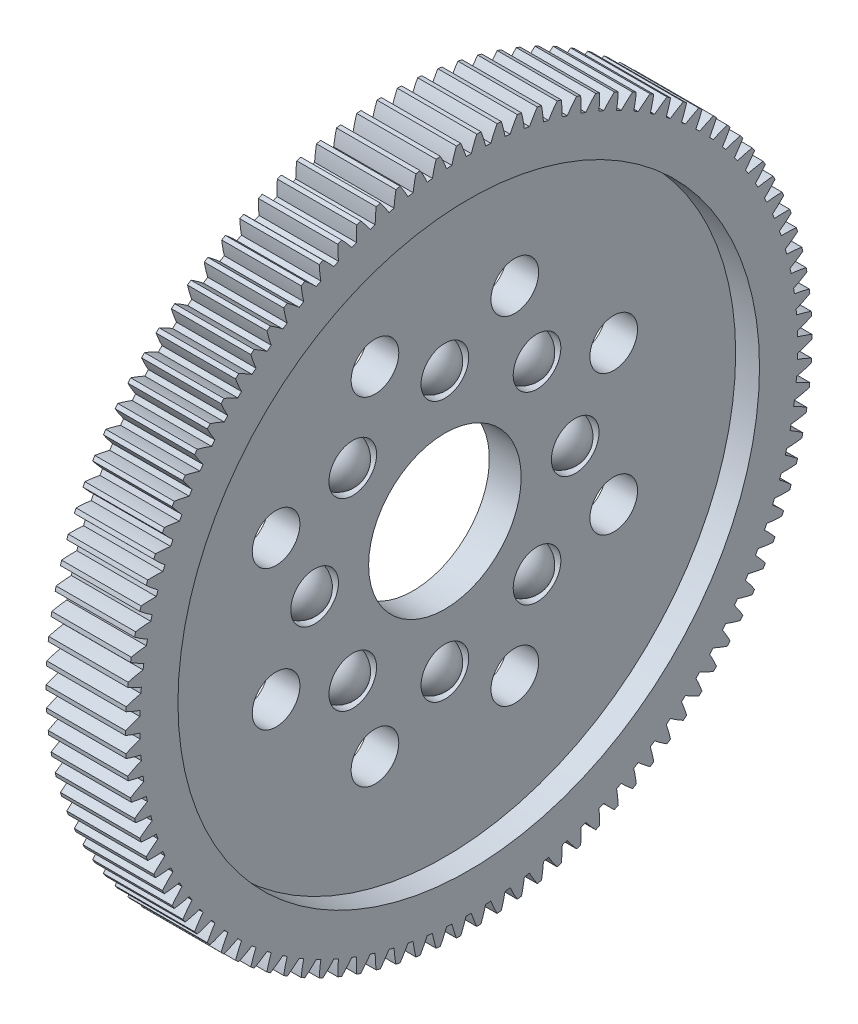
from build123d import *

# Parameters (mm, degrees)
BASPROSKE_W                    = 5
BASPROSKE_H                    = 21.6
TOOTHCUT_DEPTH                 = 31.953513532
TEETHCUTS_COUNT                = 106
BORSKE_R                       = 4.8
BORE_DEPTH                     = 50.0000508
SKETCH2_R                      = 18.3
CUT_EXTRUDE1_DEPTH             = 1.5
CUT_EXTRUDE2_REACH             = 32.645
SKETCH3_R                      = 1.5
CUT_EXTRUDE2_DIRECTION_2_REACH = 32.645
CIRPATTERN3_COUNT              = 8


with BuildPart() as part:
    # BasProSke → Base-Revolve (revolve)
    with BuildSketch(Plane(origin=(0, 0, 0), x_dir=(1, 0, 0), z_dir=(0, 1, 0))):
        with Locations((2.5, 10.8)):
            Rectangle(BASPROSKE_W, BASPROSKE_H)
    revolve(axis=Axis((-10, 0, 0), (1, 0, 0)))

    # TooCutSke → ToothCut (cut, through all)
    with BuildSketch(Plane(origin=(0, 0, 0), x_dir=(0, 0, -1), z_dir=(1, 0, 0))):
        with BuildLine():
            ThreePointArc((0.164803514, 20.698343914), (0, 20.699), (-0.164803514, 20.698343914))
            ThreePointArc((-0.164803514, 20.698343914), (-0.327553518, 21.163904781), (-0.517093365, 21.619216906))
            ThreePointArc((-0.517093365, 21.619216906), (0, 21.6254), (0.517093365, 21.619216906))
            ThreePointArc((0.517093365, 21.619216906), (0.327553518, 21.163904781), (0.164803514, 20.698343914))
        make_face()
    toothcut = extrude(amount=TOOTHCUT_DEPTH, mode=Mode.SUBTRACT)

    # TeethCuts: ToothCut ×106 about axis
    teethcuts_axis = Axis((-10, 0, 0), (1, 0, 0))
    for i in range(1, TEETHCUTS_COUNT):
        add(toothcut.rotate(teethcuts_axis, i * 360 / TEETHCUTS_COUNT), mode=Mode.SUBTRACT)

    # BorSke → Bore (cut, symmetric)
    with BuildSketch(Plane(origin=(0, 0, 0), x_dir=(0, 0, -1), z_dir=(1, 0, 0))):
        with Locations(Location((0, 0, 0), (0, 0, 180))):
            Circle(BORSKE_R)
    extrude(amount=BORE_DEPTH, both=True, mode=Mode.SUBTRACT)

    # Sketch2 → Cut-Extrude1 (cut)
    with BuildSketch(Plane(origin=(5, 0, 0), x_dir=(0, 0, -1), z_dir=(1, 0, 0))):
        Circle(SKETCH2_R)
    cut_extrude1 = extrude(amount=-CUT_EXTRUDE1_DEPTH, mode=Mode.SUBTRACT)

    # Mirror1: Cut-Extrude1 across plane
    add(cut_extrude1.mirror(Plane(origin=(2.5, 0, 0), x_dir=(0, 0, 1), z_dir=(1, 0, 0))), mode=Mode.SUBTRACT)

    # Sketch3 → Cut-Extrude2 (cut, up to next)
    with BuildSketch(Plane(origin=(2.5, 0, 0), x_dir=(0, 0, -1), z_dir=(1, 0, 0)), mode=Mode.PRIVATE) as cut_extrude2_sk1:
        with Locations(Location((0, 8.2, 0), (0, 0, 180))):
            Circle(SKETCH3_R)
    cut_extrude2_tool1 = extrude(cut_extrude2_sk1.sketch, amount=-CUT_EXTRUDE2_REACH, mode=Mode.PRIVATE) & part.part
    # Sketch3 → Cut-Extrude2 (cut, up to next)
    with BuildSketch(Plane(origin=(2.5, 0, 0), x_dir=(0, 0, -1), z_dir=(1, 0, 0)), mode=Mode.PRIVATE) as cut_extrude2_sk2:
        with Locations(Location((5.798275606, 5.798275606, 0), (0, 0, 180))):
            Circle(SKETCH3_R)
    cut_extrude2_tool2 = extrude(cut_extrude2_sk2.sketch, amount=-CUT_EXTRUDE2_REACH, mode=Mode.PRIVATE) & part.part
    # Sketch3 → Cut-Extrude2 (cut, up to next)
    with BuildSketch(Plane(origin=(2.5, 0, 0), x_dir=(0, 0, -1), z_dir=(1, 0, 0)), mode=Mode.PRIVATE) as cut_extrude2_sk3:
        with Locations(Location((8.2, 0, 0), (0, 0, 180))):
            Circle(SKETCH3_R)
    cut_extrude2_tool3 = extrude(cut_extrude2_sk3.sketch, amount=-CUT_EXTRUDE2_REACH, mode=Mode.PRIVATE) & part.part
    # Sketch3 → Cut-Extrude2 (cut, up to next)
    with BuildSketch(Plane(origin=(2.5, 0, 0), x_dir=(0, 0, -1), z_dir=(1, 0, 0)), mode=Mode.PRIVATE) as cut_extrude2_sk4:
        with Locations(Location((5.798275606, -5.798275606, 0), (0, 0, 180))):
            Circle(SKETCH3_R)
    cut_extrude2_tool4 = extrude(cut_extrude2_sk4.sketch, amount=-CUT_EXTRUDE2_REACH, mode=Mode.PRIVATE) & part.part
    # Sketch3 → Cut-Extrude2 (cut, up to next)
    with BuildSketch(Plane(origin=(2.5, 0, 0), x_dir=(0, 0, -1), z_dir=(1, 0, 0)), mode=Mode.PRIVATE) as cut_extrude2_sk5:
        with Locations(Location((0, -8.2, 0), (0, 0, 180))):
            Circle(SKETCH3_R)
    cut_extrude2_tool5 = extrude(cut_extrude2_sk5.sketch, amount=-CUT_EXTRUDE2_REACH, mode=Mode.PRIVATE) & part.part
    # Sketch3 → Cut-Extrude2 (cut, up to next)
    with BuildSketch(Plane(origin=(2.5, 0, 0), x_dir=(0, 0, -1), z_dir=(1, 0, 0)), mode=Mode.PRIVATE) as cut_extrude2_sk6:
        with Locations(Location((-5.798275606, -5.798275606, 0), (0, 0, 180))):
            Circle(SKETCH3_R)
    cut_extrude2_tool6 = extrude(cut_extrude2_sk6.sketch, amount=-CUT_EXTRUDE2_REACH, mode=Mode.PRIVATE) & part.part
    # Sketch3 → Cut-Extrude2 (cut, up to next)
    with BuildSketch(Plane(origin=(2.5, 0, 0), x_dir=(0, 0, -1), z_dir=(1, 0, 0)), mode=Mode.PRIVATE) as cut_extrude2_sk7:
        with Locations(Location((-8.2, 0, 0), (0, 0, 180))):
            Circle(SKETCH3_R)
    cut_extrude2_tool7 = extrude(cut_extrude2_sk7.sketch, amount=-CUT_EXTRUDE2_REACH, mode=Mode.PRIVATE) & part.part
    # Sketch3 → Cut-Extrude2 (cut, up to next)
    with BuildSketch(Plane(origin=(2.5, 0, 0), x_dir=(0, 0, -1), z_dir=(1, 0, 0)), mode=Mode.PRIVATE) as cut_extrude2_sk8:
        with Locations(Location((-5.798275606, 5.798275606, 0), (0, 0, 180))):
            Circle(SKETCH3_R)
    cut_extrude2_tool8 = extrude(cut_extrude2_sk8.sketch, amount=-CUT_EXTRUDE2_REACH, mode=Mode.PRIVATE) & part.part
    # Sketch3 → Cut-Extrude2 (cut, up to next)
    with BuildSketch(Plane(origin=(2.5, 0, 0), x_dir=(0, 0, -1), z_dir=(1, 0, 0)), mode=Mode.PRIVATE) as cut_extrude2_sk9:
        with Locations(Location((-4.400859472, 10.624614624, 0), (0, 0, 180))):
            Circle(SKETCH3_R)
    cut_extrude2_tool9 = extrude(cut_extrude2_sk9.sketch, amount=-CUT_EXTRUDE2_REACH, mode=Mode.PRIVATE) & part.part
    # Sketch3 → Cut-Extrude2 (cut, up to next)
    with BuildSketch(Plane(origin=(2.5, 0, 0), x_dir=(0, 0, -1), z_dir=(1, 0, 0)), mode=Mode.PRIVATE) as cut_extrude2_sk10:
        with Locations(Location((4.400859472, 10.624614624, 0), (0, 0, 180))):
            Circle(SKETCH3_R)
    cut_extrude2_tool10 = extrude(cut_extrude2_sk10.sketch, amount=-CUT_EXTRUDE2_REACH, mode=Mode.PRIVATE) & part.part
    # Sketch3 → Cut-Extrude2 (cut, up to next)
    with BuildSketch(Plane(origin=(2.5, 0, 0), x_dir=(0, 0, -1), z_dir=(1, 0, 0)), mode=Mode.PRIVATE) as cut_extrude2_sk11:
        with Locations(Location((10.624614624, 4.400859472, 0), (0, 0, 180))):
            Circle(SKETCH3_R)
    cut_extrude2_tool11 = extrude(cut_extrude2_sk11.sketch, amount=-CUT_EXTRUDE2_REACH, mode=Mode.PRIVATE) & part.part
    # Sketch3 → Cut-Extrude2 (cut, up to next)
    with BuildSketch(Plane(origin=(2.5, 0, 0), x_dir=(0, 0, -1), z_dir=(1, 0, 0)), mode=Mode.PRIVATE) as cut_extrude2_sk12:
        with Locations(Location((10.624614624, -4.400859472, 0), (0, 0, 180))):
            Circle(SKETCH3_R)
    cut_extrude2_tool12 = extrude(cut_extrude2_sk12.sketch, amount=-CUT_EXTRUDE2_REACH, mode=Mode.PRIVATE) & part.part
    # Sketch3 → Cut-Extrude2 (cut, up to next)
    with BuildSketch(Plane(origin=(2.5, 0, 0), x_dir=(0, 0, -1), z_dir=(1, 0, 0)), mode=Mode.PRIVATE) as cut_extrude2_sk13:
        with Locations(Location((4.400859472, -10.624614624, 0), (0, 0, 180))):
            Circle(SKETCH3_R)
    cut_extrude2_tool13 = extrude(cut_extrude2_sk13.sketch, amount=-CUT_EXTRUDE2_REACH, mode=Mode.PRIVATE) & part.part
    # Sketch3 → Cut-Extrude2 (cut, up to next)
    with BuildSketch(Plane(origin=(2.5, 0, 0), x_dir=(0, 0, -1), z_dir=(1, 0, 0)), mode=Mode.PRIVATE) as cut_extrude2_sk14:
        with Locations(Location((-4.400859472, -10.624614624, 0), (0, 0, 180))):
            Circle(SKETCH3_R)
    cut_extrude2_tool14 = extrude(cut_extrude2_sk14.sketch, amount=-CUT_EXTRUDE2_REACH, mode=Mode.PRIVATE) & part.part
    # Sketch3 → Cut-Extrude2 (cut, up to next)
    with BuildSketch(Plane(origin=(2.5, 0, 0), x_dir=(0, 0, -1), z_dir=(1, 0, 0)), mode=Mode.PRIVATE) as cut_extrude2_sk15:
        with Locations(Location((-10.624614624, -4.400859472, 0), (0, 0, 180))):
            Circle(SKETCH3_R)
    cut_extrude2_tool15 = extrude(cut_extrude2_sk15.sketch, amount=-CUT_EXTRUDE2_REACH, mode=Mode.PRIVATE) & part.part
    # Sketch3 → Cut-Extrude2 (cut, up to next)
    with BuildSketch(Plane(origin=(2.5, 0, 0), x_dir=(0, 0, -1), z_dir=(1, 0, 0)), mode=Mode.PRIVATE) as cut_extrude2_sk16:
        with Locations(Location((-10.624614624, 4.400859472, 0), (0, 0, 180))):
            Circle(SKETCH3_R)
    cut_extrude2_tool16 = extrude(cut_extrude2_sk16.sketch, amount=-CUT_EXTRUDE2_REACH, mode=Mode.PRIVATE) & part.part
    add(cut_extrude2_tool1.solids().sort_by_distance((2.5, 8.2, 0))[0], mode=Mode.SUBTRACT)
    add(cut_extrude2_tool2.solids().sort_by_distance((2.5, 5.798276, -5.798276))[0], mode=Mode.SUBTRACT)
    add(cut_extrude2_tool3.solids().sort_by_distance((2.5, 0, -8.2))[0], mode=Mode.SUBTRACT)
    add(cut_extrude2_tool4.solids().sort_by_distance((2.5, -5.798276, -5.798276))[0], mode=Mode.SUBTRACT)
    add(cut_extrude2_tool5.solids().sort_by_distance((2.5, -8.2, 0))[0], mode=Mode.SUBTRACT)
    add(cut_extrude2_tool6.solids().sort_by_distance((2.5, -5.798276, 5.798276))[0], mode=Mode.SUBTRACT)
    add(cut_extrude2_tool7.solids().sort_by_distance((2.5, 0, 8.2))[0], mode=Mode.SUBTRACT)
    add(cut_extrude2_tool8.solids().sort_by_distance((2.5, 5.798276, 5.798276))[0], mode=Mode.SUBTRACT)
    add(cut_extrude2_tool9.solids().sort_by_distance((2.5, 10.624615, 4.400859))[0], mode=Mode.SUBTRACT)
    add(cut_extrude2_tool10.solids().sort_by_distance((2.5, 10.624615, -4.400859))[0], mode=Mode.SUBTRACT)
    add(cut_extrude2_tool11.solids().sort_by_distance((2.5, 4.400859, -10.624615))[0], mode=Mode.SUBTRACT)
    add(cut_extrude2_tool12.solids().sort_by_distance((2.5, -4.400859, -10.624615))[0], mode=Mode.SUBTRACT)
    add(cut_extrude2_tool13.solids().sort_by_distance((2.5, -10.624615, -4.400859))[0], mode=Mode.SUBTRACT)
    add(cut_extrude2_tool14.solids().sort_by_distance((2.5, -10.624615, 4.400859))[0], mode=Mode.SUBTRACT)
    add(cut_extrude2_tool15.solids().sort_by_distance((2.5, -4.400859, 10.624615))[0], mode=Mode.SUBTRACT)
    add(cut_extrude2_tool16.solids().sort_by_distance((2.5, 4.400859, 10.624615))[0], mode=Mode.SUBTRACT)

    # Sketch3 → Cut-Extrude2 direction 2 (cut, up to next)
    with BuildSketch(Plane(origin=(2.5, 0, 0), x_dir=(0, 0, -1), z_dir=(1, 0, 0)), mode=Mode.PRIVATE) as cut_extrude2_direction_2_sk1:
        with Locations(Location((0, 8.2, 0), (0, 0, 180))):
            Circle(SKETCH3_R)
    cut_extrude2_direction_2_tool1 = extrude(cut_extrude2_direction_2_sk1.sketch, amount=CUT_EXTRUDE2_DIRECTION_2_REACH, mode=Mode.PRIVATE) & part.part
    # Sketch3 → Cut-Extrude2 direction 2 (cut, up to next)
    with BuildSketch(Plane(origin=(2.5, 0, 0), x_dir=(0, 0, -1), z_dir=(1, 0, 0)), mode=Mode.PRIVATE) as cut_extrude2_direction_2_sk2:
        with Locations(Location((5.798275606, 5.798275606, 0), (0, 0, 180))):
            Circle(SKETCH3_R)
    cut_extrude2_direction_2_tool2 = extrude(cut_extrude2_direction_2_sk2.sketch, amount=CUT_EXTRUDE2_DIRECTION_2_REACH, mode=Mode.PRIVATE) & part.part
    # Sketch3 → Cut-Extrude2 direction 2 (cut, up to next)
    with BuildSketch(Plane(origin=(2.5, 0, 0), x_dir=(0, 0, -1), z_dir=(1, 0, 0)), mode=Mode.PRIVATE) as cut_extrude2_direction_2_sk3:
        with Locations(Location((8.2, 0, 0), (0, 0, 180))):
            Circle(SKETCH3_R)
    cut_extrude2_direction_2_tool3 = extrude(cut_extrude2_direction_2_sk3.sketch, amount=CUT_EXTRUDE2_DIRECTION_2_REACH, mode=Mode.PRIVATE) & part.part
    # Sketch3 → Cut-Extrude2 direction 2 (cut, up to next)
    with BuildSketch(Plane(origin=(2.5, 0, 0), x_dir=(0, 0, -1), z_dir=(1, 0, 0)), mode=Mode.PRIVATE) as cut_extrude2_direction_2_sk4:
        with Locations(Location((5.798275606, -5.798275606, 0), (0, 0, 180))):
            Circle(SKETCH3_R)
    cut_extrude2_direction_2_tool4 = extrude(cut_extrude2_direction_2_sk4.sketch, amount=CUT_EXTRUDE2_DIRECTION_2_REACH, mode=Mode.PRIVATE) & part.part
    # Sketch3 → Cut-Extrude2 direction 2 (cut, up to next)
    with BuildSketch(Plane(origin=(2.5, 0, 0), x_dir=(0, 0, -1), z_dir=(1, 0, 0)), mode=Mode.PRIVATE) as cut_extrude2_direction_2_sk5:
        with Locations(Location((0, -8.2, 0), (0, 0, 180))):
            Circle(SKETCH3_R)
    cut_extrude2_direction_2_tool5 = extrude(cut_extrude2_direction_2_sk5.sketch, amount=CUT_EXTRUDE2_DIRECTION_2_REACH, mode=Mode.PRIVATE) & part.part
    # Sketch3 → Cut-Extrude2 direction 2 (cut, up to next)
    with BuildSketch(Plane(origin=(2.5, 0, 0), x_dir=(0, 0, -1), z_dir=(1, 0, 0)), mode=Mode.PRIVATE) as cut_extrude2_direction_2_sk6:
        with Locations(Location((-5.798275606, -5.798275606, 0), (0, 0, 180))):
            Circle(SKETCH3_R)
    cut_extrude2_direction_2_tool6 = extrude(cut_extrude2_direction_2_sk6.sketch, amount=CUT_EXTRUDE2_DIRECTION_2_REACH, mode=Mode.PRIVATE) & part.part
    # Sketch3 → Cut-Extrude2 direction 2 (cut, up to next)
    with BuildSketch(Plane(origin=(2.5, 0, 0), x_dir=(0, 0, -1), z_dir=(1, 0, 0)), mode=Mode.PRIVATE) as cut_extrude2_direction_2_sk7:
        with Locations(Location((-8.2, 0, 0), (0, 0, 180))):
            Circle(SKETCH3_R)
    cut_extrude2_direction_2_tool7 = extrude(cut_extrude2_direction_2_sk7.sketch, amount=CUT_EXTRUDE2_DIRECTION_2_REACH, mode=Mode.PRIVATE) & part.part
    # Sketch3 → Cut-Extrude2 direction 2 (cut, up to next)
    with BuildSketch(Plane(origin=(2.5, 0, 0), x_dir=(0, 0, -1), z_dir=(1, 0, 0)), mode=Mode.PRIVATE) as cut_extrude2_direction_2_sk8:
        with Locations(Location((-5.798275606, 5.798275606, 0), (0, 0, 180))):
            Circle(SKETCH3_R)
    cut_extrude2_direction_2_tool8 = extrude(cut_extrude2_direction_2_sk8.sketch, amount=CUT_EXTRUDE2_DIRECTION_2_REACH, mode=Mode.PRIVATE) & part.part
    # Sketch3 → Cut-Extrude2 direction 2 (cut, up to next)
    with BuildSketch(Plane(origin=(2.5, 0, 0), x_dir=(0, 0, -1), z_dir=(1, 0, 0)), mode=Mode.PRIVATE) as cut_extrude2_direction_2_sk9:
        with Locations(Location((-4.400859472, 10.624614624, 0), (0, 0, 180))):
            Circle(SKETCH3_R)
    cut_extrude2_direction_2_tool9 = extrude(cut_extrude2_direction_2_sk9.sketch, amount=CUT_EXTRUDE2_DIRECTION_2_REACH, mode=Mode.PRIVATE) & part.part
    # Sketch3 → Cut-Extrude2 direction 2 (cut, up to next)
    with BuildSketch(Plane(origin=(2.5, 0, 0), x_dir=(0, 0, -1), z_dir=(1, 0, 0)), mode=Mode.PRIVATE) as cut_extrude2_direction_2_sk10:
        with Locations(Location((4.400859472, 10.624614624, 0), (0, 0, 180))):
            Circle(SKETCH3_R)
    cut_extrude2_direction_2_tool10 = extrude(cut_extrude2_direction_2_sk10.sketch, amount=CUT_EXTRUDE2_DIRECTION_2_REACH, mode=Mode.PRIVATE) & part.part
    # Sketch3 → Cut-Extrude2 direction 2 (cut, up to next)
    with BuildSketch(Plane(origin=(2.5, 0, 0), x_dir=(0, 0, -1), z_dir=(1, 0, 0)), mode=Mode.PRIVATE) as cut_extrude2_direction_2_sk11:
        with Locations(Location((10.624614624, 4.400859472, 0), (0, 0, 180))):
            Circle(SKETCH3_R)
    cut_extrude2_direction_2_tool11 = extrude(cut_extrude2_direction_2_sk11.sketch, amount=CUT_EXTRUDE2_DIRECTION_2_REACH, mode=Mode.PRIVATE) & part.part
    # Sketch3 → Cut-Extrude2 direction 2 (cut, up to next)
    with BuildSketch(Plane(origin=(2.5, 0, 0), x_dir=(0, 0, -1), z_dir=(1, 0, 0)), mode=Mode.PRIVATE) as cut_extrude2_direction_2_sk12:
        with Locations(Location((10.624614624, -4.400859472, 0), (0, 0, 180))):
            Circle(SKETCH3_R)
    cut_extrude2_direction_2_tool12 = extrude(cut_extrude2_direction_2_sk12.sketch, amount=CUT_EXTRUDE2_DIRECTION_2_REACH, mode=Mode.PRIVATE) & part.part
    # Sketch3 → Cut-Extrude2 direction 2 (cut, up to next)
    with BuildSketch(Plane(origin=(2.5, 0, 0), x_dir=(0, 0, -1), z_dir=(1, 0, 0)), mode=Mode.PRIVATE) as cut_extrude2_direction_2_sk13:
        with Locations(Location((4.400859472, -10.624614624, 0), (0, 0, 180))):
            Circle(SKETCH3_R)
    cut_extrude2_direction_2_tool13 = extrude(cut_extrude2_direction_2_sk13.sketch, amount=CUT_EXTRUDE2_DIRECTION_2_REACH, mode=Mode.PRIVATE) & part.part
    # Sketch3 → Cut-Extrude2 direction 2 (cut, up to next)
    with BuildSketch(Plane(origin=(2.5, 0, 0), x_dir=(0, 0, -1), z_dir=(1, 0, 0)), mode=Mode.PRIVATE) as cut_extrude2_direction_2_sk14:
        with Locations(Location((-4.400859472, -10.624614624, 0), (0, 0, 180))):
            Circle(SKETCH3_R)
    cut_extrude2_direction_2_tool14 = extrude(cut_extrude2_direction_2_sk14.sketch, amount=CUT_EXTRUDE2_DIRECTION_2_REACH, mode=Mode.PRIVATE) & part.part
    # Sketch3 → Cut-Extrude2 direction 2 (cut, up to next)
    with BuildSketch(Plane(origin=(2.5, 0, 0), x_dir=(0, 0, -1), z_dir=(1, 0, 0)), mode=Mode.PRIVATE) as cut_extrude2_direction_2_sk15:
        with Locations(Location((-10.624614624, -4.400859472, 0), (0, 0, 180))):
            Circle(SKETCH3_R)
    cut_extrude2_direction_2_tool15 = extrude(cut_extrude2_direction_2_sk15.sketch, amount=CUT_EXTRUDE2_DIRECTION_2_REACH, mode=Mode.PRIVATE) & part.part
    # Sketch3 → Cut-Extrude2 direction 2 (cut, up to next)
    with BuildSketch(Plane(origin=(2.5, 0, 0), x_dir=(0, 0, -1), z_dir=(1, 0, 0)), mode=Mode.PRIVATE) as cut_extrude2_direction_2_sk16:
        with Locations(Location((-10.624614624, 4.400859472, 0), (0, 0, 180))):
            Circle(SKETCH3_R)
    cut_extrude2_direction_2_tool16 = extrude(cut_extrude2_direction_2_sk16.sketch, amount=CUT_EXTRUDE2_DIRECTION_2_REACH, mode=Mode.PRIVATE) & part.part
    add(cut_extrude2_direction_2_tool1.solids().sort_by_distance((2.5, 8.2, 0))[0], mode=Mode.SUBTRACT)
    add(cut_extrude2_direction_2_tool2.solids().sort_by_distance((2.5, 5.798276, -5.798276))[0], mode=Mode.SUBTRACT)
    add(cut_extrude2_direction_2_tool3.solids().sort_by_distance((2.5, 0, -8.2))[0], mode=Mode.SUBTRACT)
    add(cut_extrude2_direction_2_tool4.solids().sort_by_distance((2.5, -5.798276, -5.798276))[0], mode=Mode.SUBTRACT)
    add(cut_extrude2_direction_2_tool5.solids().sort_by_distance((2.5, -8.2, 0))[0], mode=Mode.SUBTRACT)
    add(cut_extrude2_direction_2_tool6.solids().sort_by_distance((2.5, -5.798276, 5.798276))[0], mode=Mode.SUBTRACT)
    add(cut_extrude2_direction_2_tool7.solids().sort_by_distance((2.5, 0, 8.2))[0], mode=Mode.SUBTRACT)
    add(cut_extrude2_direction_2_tool8.solids().sort_by_distance((2.5, 5.798276, 5.798276))[0], mode=Mode.SUBTRACT)
    add(cut_extrude2_direction_2_tool9.solids().sort_by_distance((2.5, 10.624615, 4.400859))[0], mode=Mode.SUBTRACT)
    add(cut_extrude2_direction_2_tool10.solids().sort_by_distance((2.5, 10.624615, -4.400859))[0], mode=Mode.SUBTRACT)
    add(cut_extrude2_direction_2_tool11.solids().sort_by_distance((2.5, 4.400859, -10.624615))[0], mode=Mode.SUBTRACT)
    add(cut_extrude2_direction_2_tool12.solids().sort_by_distance((2.5, -4.400859, -10.624615))[0], mode=Mode.SUBTRACT)
    add(cut_extrude2_direction_2_tool13.solids().sort_by_distance((2.5, -10.624615, -4.400859))[0], mode=Mode.SUBTRACT)
    add(cut_extrude2_direction_2_tool14.solids().sort_by_distance((2.5, -10.624615, 4.400859))[0], mode=Mode.SUBTRACT)
    add(cut_extrude2_direction_2_tool15.solids().sort_by_distance((2.5, -4.400859, 10.624615))[0], mode=Mode.SUBTRACT)
    add(cut_extrude2_direction_2_tool16.solids().sort_by_distance((2.5, 4.400859, 10.624615))[0], mode=Mode.SUBTRACT)

    # Sketch4 → Revolve1 (revolve)
    with BuildSketch(Plane(origin=(2.5, 0, 0), x_dir=(0, 0, -1), z_dir=(1, 0, 0))):
        with BuildLine():
            Line((0, 9.701), (0, 6.699))
            ThreePointArc((0, 6.699), (1.501, 8.2), (0, 9.701))
        make_face()
    revolve1 = revolve(axis=Axis((2.5, 9.701, 0), (0, -1, 0)))

    # CirPattern3: Revolve1 ×8 about axis
    cirpattern3_axis = Axis((-80.9, 0, 0), (1, 0, 0))
    for i in range(1, CIRPATTERN3_COUNT):
        add(revolve1.rotate(cirpattern3_axis, i * 360 / CIRPATTERN3_COUNT))


solid = part.part
